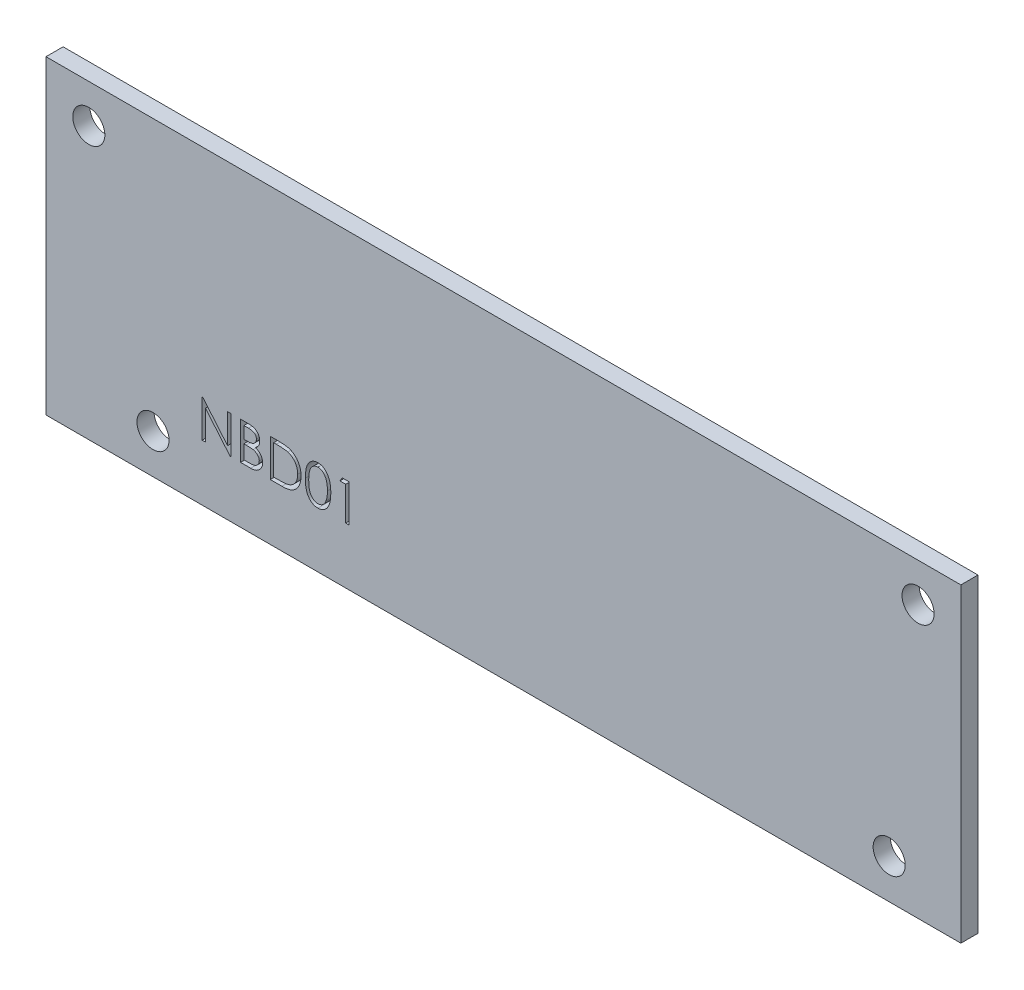
from build123d import *

# Parameters (mm, degrees)
SCHIZZO1_W                   = 85.5
SCHIZZO1_H                   = 29
ESTRUSIONE_ESTRUSIONE1_DEPTH = 1.6
SCHIZZO2_R                   = 1.5
TAGLIO_ESTRUSIONE1_DEPTH     = 1.6


with BuildPart() as part:
    # Schizzo1 → Estrusione-Estrusione1 (new body)
    with BuildSketch(Plane.XY):
        Rectangle(SCHIZZO1_W, SCHIZZO1_H)
    extrude(amount=ESTRUSIONE_ESTRUSIONE1_DEPTH)

    # Schizzo2 → Taglio-Estrusione1 (cut)
    # profile 1 of 9: a face of its own
    with BuildSketch(Plane.XY.offset(1.6)):
        with Locations((-32.75, -10.8)):
            Circle(SCHIZZO2_R)
    # profile 2 of 9: a face of its own
    with BuildSketch(Plane.XY.offset(1.6)):
        with Locations((36.05, -10.8)):
            Circle(SCHIZZO2_R)
    # profile 3 of 9: a face of its own
    with BuildSketch(Plane.XY.offset(1.6)):
        with Locations((38.75, 10.9)):
            Circle(SCHIZZO2_R)
    # profile 4 of 9: a face of its own
    with BuildSketch(Plane.XY.offset(1.6)):
        with Locations((-38.75, 10.9)):
            Circle(SCHIZZO2_R)
    # profile 5 of 9: a face of its own
    with BuildSketch(Plane.XY.offset(1.6)):
        Polygon((-28.159058357, -9.243738305), (-28.159058357, -5.743738305), (-28.093152909, -5.743738305), (-25.780853229, -8.498445837), (-25.780853229, -5.743738305), (-25.466750665, -5.743738305), (-25.466750665, -9.243738305), (-25.538265088, -9.243738305), (-27.844955793, -6.495340869), (-27.844955793, -9.243738305), align=None)
    # profile 6 of 9: a face of its own
    with BuildSketch(Plane.XY.offset(1.6)):
        with BuildLine():
            Line((-24.569314767, -5.743738305), (-23.886422139, -5.743738305))
            add(Edge.make_bspline(
                [(-23.886422139, -5.743738305), (-23.852993661, -5.743914055), (-23.788200951, -5.744254703), (-23.693981509, -5.749537835), (-23.605732698, -5.756741504), (-23.523428926, -5.768171597), (-23.447108224, -5.781963374), (-23.376540586, -5.79866519), (-23.311950414, -5.818691804), (-23.234837678, -5.850538085), (-23.146917017, -5.897861254), (-23.051718624, -5.967789819), (-22.970314385, -6.053322282), (-22.900128067, -6.149804937), (-22.844326948, -6.255940709), (-22.803957651, -6.369199898), (-22.778399775, -6.48812164), (-22.775771341, -6.569764818), (-22.774442973, -6.611025965)],
                knots=[0, 0, 0, 0, 1.001505555, 1.941167018, 2.826882275, 3.653841531, 4.429895133, 5.150066043, 5.825578002, 6.45369114, 7.647487171, 8.808567382, 9.977351308, 11.170798116, 12.373658725, 13.556498008, 14.765093433, 16, 16, 16, 16], degree=3))
            add(Edge.make_bspline(
                [(-22.774442973, -6.611025965), (-22.775536191, -6.649678521), (-22.777684468, -6.725634438), (-22.798227228, -6.836728547), (-22.830387896, -6.942479766), (-22.875093145, -7.042502151), (-22.933195142, -7.134535765), (-23.00205346, -7.219323031), (-23.085130263, -7.293274088), (-23.147373503, -7.33461699), (-23.178990248, -7.355617311)],
                knots=[0, 0, 0, 0, 1.044552857, 2.05264487, 3.044412934, 4.028983338, 5.005914585, 5.980388656, 6.974128949, 8, 8, 8, 8], degree=3))
            add(Edge.make_bspline(
                [(-23.178990248, -7.355617311), (-23.139229821, -7.37088231), (-23.063158273, -7.400088035), (-22.958472261, -7.451723499), (-22.868277416, -7.507885609), (-22.79188027, -7.569217459), (-22.726542615, -7.63532627), (-22.669489673, -7.707181384), (-22.620808299, -7.785720142), (-22.579095376, -7.870123678), (-22.54654662, -7.959530146), (-22.522170715, -8.053100922), (-22.508203266, -8.150500477), (-22.506215625, -8.216785857), (-22.505212203, -8.250248722)],
                knots=[0, 0, 0, 0, 1.27268992, 2.434971085, 3.483601985, 4.442670788, 5.356604649, 6.2567628, 7.179492994, 8.113709626, 9.066344395, 10.018646069, 10.999752585, 12, 12, 12, 12], degree=3))
            add(Edge.make_bspline(
                [(-22.505212203, -8.250248722), (-22.506189049, -8.284415594), (-22.508111021, -8.351639872), (-22.522290993, -8.450395006), (-22.5463001, -8.544769953), (-22.579371246, -8.635375136), (-22.622533561, -8.72203527), (-22.675061525, -8.804848534), (-22.737693089, -8.882982865), (-22.807755958, -8.957306488), (-22.887018103, -9.024134275), (-22.972533858, -9.083649982), (-23.065380178, -9.132596044), (-23.164032172, -9.173712066), (-23.269596488, -9.205119264), (-23.381599096, -9.227091838), (-23.499943398, -9.241896875), (-23.581153149, -9.24311408), (-23.622800344, -9.243738305)],
                knots=[0, 0, 0, 0, 0.978564426, 1.925352924, 2.850884081, 3.763762016, 4.682927383, 5.618979971, 6.567305752, 7.547517671, 8.540179244, 9.531824382, 10.526200242, 11.540722885, 12.589160233, 13.674978461, 14.80764778, 16, 16, 16, 16], degree=3))
            Line((-23.622800344, -9.243738305), (-24.569314767, -9.243738305))
            Line((-24.569314767, -9.243738305), (-24.569314767, -5.743738305))
        make_face()
        with BuildLine():
            Line((-24.255212203, -6.102712664), (-24.255212203, -7.224507536))
            Line((-24.255212203, -7.224507536), (-24.044174543, -7.224507536))
            add(Edge.make_bspline(
                [(-24.044174543, -7.224507536), (-24.013325748, -7.224107613), (-23.953719589, -7.22333488), (-23.867399692, -7.221121363), (-23.787274674, -7.21492332), (-23.713482841, -7.208727057), (-23.646140397, -7.19865247), (-23.585396535, -7.186660347), (-23.530297938, -7.173977442), (-23.466758393, -7.152407955), (-23.394685444, -7.12053028), (-23.31785234, -7.071058444), (-23.250117871, -7.01213409), (-23.192920683, -6.944143129), (-23.146109212, -6.869276943), (-23.113595497, -6.788730062), (-23.091548213, -6.70450993), (-23.089556682, -6.646691678), (-23.088545537, -6.617336061)],
                knots=[0, 0, 0, 0, 1.156816544, 2.235205308, 3.236616184, 4.169592532, 5.011045266, 5.787822928, 6.49130361, 7.128639758, 8.301311294, 9.436451833, 10.541879658, 11.654887649, 12.756523258, 13.837046038, 14.901820046, 16, 16, 16, 16], degree=3))
            add(Edge.make_bspline(
                [(-23.088545537, -6.617336061), (-23.089071717, -6.59791029), (-23.090103877, -6.559804518), (-23.098557179, -6.504255164), (-23.112924754, -6.452011411), (-23.131379047, -6.402357301), (-23.157167736, -6.356845451), (-23.187531199, -6.313902255), (-23.224216889, -6.274990136), (-23.265974202, -6.238620638), (-23.313982825, -6.20637611), (-23.368214117, -6.178135347), (-23.429401794, -6.15539457), (-23.496514649, -6.135478418), (-23.570585736, -6.121490124), (-23.65076029, -6.109836736), (-23.737695009, -6.103903994), (-23.797840111, -6.103118632), (-23.828930152, -6.102712664)],
                knots=[0, 0, 0, 0, 0.91205012, 1.789085906, 2.630437955, 3.453916878, 4.269457761, 5.079663411, 5.91843418, 6.774407191, 7.675494373, 8.627863946, 9.638891023, 10.736472738, 11.911756761, 13.175263542, 14.539845004, 16, 16, 16, 16], degree=3))
            Line((-23.828930152, -6.102712664), (-24.255212203, -6.102712664))
        make_face(mode=Mode.SUBTRACT)
        with BuildLine():
            Line((-24.255212203, -7.583481895), (-24.255212203, -8.884763946))
            Line((-24.255212203, -8.884763946), (-23.807896498, -8.884763946))
            add(Edge.make_bspline(
                [(-23.807896498, -8.884763946), (-23.775877572, -8.884380199), (-23.714165314, -8.883640576), (-23.625064084, -8.881226022), (-23.54248098, -8.875733746), (-23.466792844, -8.867087896), (-23.397182391, -8.857709447), (-23.334484688, -8.845098166), (-23.278191495, -8.830649206), (-23.212917187, -8.808315033), (-23.139413679, -8.773618562), (-23.060202823, -8.721304336), (-22.989776604, -8.658981028), (-22.929971345, -8.586850114), (-22.880958357, -8.508418787), (-22.845302902, -8.425273437), (-22.823312045, -8.33878791), (-22.820649876, -8.279821197), (-22.819314767, -8.250248722)],
                knots=[0, 0, 0, 0, 1.160039823, 2.235823828, 3.228722157, 4.157150951, 4.99529583, 5.772374946, 6.472645482, 7.099169577, 8.269452708, 9.405989375, 10.527446681, 11.663510218, 12.788923519, 13.866172445, 14.929861265, 16, 16, 16, 16], degree=3))
            add(Edge.make_bspline(
                [(-22.819314767, -8.250248722), (-22.819590872, -8.231755381), (-22.820138627, -8.195066999), (-22.828399242, -8.14115118), (-22.840413112, -8.088925307), (-22.855944546, -8.038247566), (-22.878564013, -7.99003419), (-22.904970558, -7.94333163), (-22.935931959, -7.898078151), (-22.984176125, -7.840865898), (-23.05434811, -7.774948885), (-23.154054885, -7.710411382), (-23.267427183, -7.658363575), (-23.349654676, -7.636264099), (-23.392131274, -7.624848081)],
                knots=[0, 0, 0, 0, 0.723448775, 1.435228256, 2.130040452, 2.821711965, 3.505591119, 4.210454504, 4.921174351, 5.648778258, 7.137944449, 8.670945889, 10.280296675, 12, 12, 12, 12], degree=3))
            add(Edge.make_bspline(
                [(-23.392131274, -7.624848081), (-23.40916037, -7.621392997), (-23.446082962, -7.613901662), (-23.506290543, -7.605993959), (-23.575026411, -7.598948899), (-23.652449289, -7.593737741), (-23.73865713, -7.588351197), (-23.833834048, -7.586256376), (-23.937591363, -7.583757116), (-24.009583736, -7.583575982), (-24.04697903, -7.583481895)],
                knots=[0, 0, 0, 0, 0.634451884, 1.375622551, 2.216452059, 3.157844607, 4.20941857, 5.370758133, 6.634282058, 8, 8, 8, 8], degree=3))
            Line((-24.04697903, -7.583481895), (-24.255212203, -7.583481895))
        make_face(mode=Mode.SUBTRACT)
    # profile 7 of 9: a face of its own
    with BuildSketch(Plane.XY.offset(1.6)):
        with BuildLine():
            Line((-21.787263485, -9.243738305), (-21.787263485, -5.743738305))
            Line((-21.787263485, -5.743738305), (-21.080532716, -5.743738305))
            add(Edge.make_bspline(
                [(-21.080532716, -5.743738305), (-21.019063728, -5.744180875), (-20.900305963, -5.745035918), (-20.728693515, -5.750457309), (-20.569909753, -5.760047775), (-20.424476894, -5.774017301), (-20.291995682, -5.791170335), (-20.172837074, -5.812670739), (-20.066384931, -5.838058909), (-20.00091549, -5.85970436), (-19.969955793, -5.869940228)],
                knots=[0, 0, 0, 0, 1.314313732, 2.53924729, 3.670748893, 4.714932338, 5.66265055, 6.526160246, 7.303039223, 8, 8, 8, 8], degree=3))
            add(Edge.make_bspline(
                [(-19.969955793, -5.869940228), (-19.929461054, -5.885370934), (-19.849389862, -5.915882428), (-19.735382739, -5.973438729), (-19.628057376, -6.038651831), (-19.526838231, -6.111607694), (-19.434037405, -6.194372042), (-19.346029508, -6.283429128), (-19.266414784, -6.382017468), (-19.193506488, -6.488092456), (-19.127770829, -6.600404508), (-19.070631671, -6.718739617), (-19.023177678, -6.842496825), (-18.983784451, -6.971331973), (-18.952737993, -7.105528351), (-18.931556062, -7.245242217), (-18.917585072, -7.389921406), (-18.91618102, -7.48809587), (-18.915468614, -7.537908978)],
                knots=[0, 0, 0, 0, 0.984719456, 1.947108742, 2.898477687, 3.838006223, 4.779231079, 5.722358779, 6.681677486, 7.655904652, 8.64651281, 9.637519902, 10.640069247, 11.656948941, 12.698408672, 13.768548281, 14.867775369, 16, 16, 16, 16], degree=3))
            add(Edge.make_bspline(
                [(-18.915468614, -7.537908978), (-18.916097581, -7.581170217), (-18.917337027, -7.666421005), (-18.928466343, -7.792061901), (-18.944642663, -7.913975472), (-18.969686861, -8.031581172), (-19.000089374, -8.14590939), (-19.039053526, -8.255741635), (-19.083689022, -8.362085444), (-19.1357389, -8.46350292), (-19.192880285, -8.559586292), (-19.254202029, -8.65016182), (-19.319638724, -8.733937042), (-19.389814357, -8.811165654), (-19.463822073, -8.881731233), (-19.542146404, -8.946223248), (-19.624989455, -9.003379803), (-19.711980178, -9.055446911), (-19.805656307, -9.100867267), (-19.907792173, -9.139297276), (-20.018823351, -9.171143892), (-20.138477308, -9.197714788), (-20.266960786, -9.21879209), (-20.404399751, -9.232918483), (-20.550583041, -9.242471415), (-20.650962306, -9.243307809), (-20.702628069, -9.243738305)],
                knots=[0, 0, 0, 0, 1.105936401, 2.179363191, 3.223086493, 4.248585256, 5.251745608, 6.245858792, 7.225916811, 8.198733463, 9.158002045, 10.082870192, 10.993790845, 11.873723703, 12.748670949, 13.606408763, 14.465103618, 15.319838547, 16.196477973, 17.123216899, 18.106603292, 19.147568657, 20.255746949, 21.433717677, 22.679120308, 24, 24, 24, 24], degree=3))
            Line((-20.702628069, -9.243738305), (-21.787263485, -9.243738305))
        make_face()
        with BuildLine():
            Line((-21.473160921, -8.884763946), (-21.071418133, -8.884763946))
            add(Edge.make_bspline(
                [(-21.071418133, -8.884763946), (-21.013689762, -8.88451585), (-20.902656964, -8.884038669), (-20.742998966, -8.879851466), (-20.59711957, -8.873009529), (-20.464998061, -8.863434451), (-20.346709036, -8.850765836), (-20.242005286, -8.836640933), (-20.151230028, -8.819043482), (-20.096300591, -8.803092523), (-20.070917332, -8.795721478)],
                knots=[0, 0, 0, 0, 1.375205317, 2.645023457, 3.804390687, 4.853969522, 5.800190428, 6.637939096, 7.370582563, 8, 8, 8, 8], degree=3))
            add(Edge.make_bspline(
                [(-20.070917332, -8.795721478), (-20.03896897, -8.78446992), (-19.975835331, -8.762235547), (-19.884954246, -8.721677885), (-19.800197241, -8.673635816), (-19.720087216, -8.620233542), (-19.645760561, -8.55958754), (-19.576336444, -8.493016551), (-19.511954643, -8.420181776), (-19.453280335, -8.341173614), (-19.400772031, -8.256483819), (-19.355300802, -8.166944985), (-19.31544927, -8.073538175), (-19.284170677, -7.974829016), (-19.259655093, -7.871699958), (-19.242290405, -7.764143744), (-19.231475681, -7.652180462), (-19.230214233, -7.576028338), (-19.229571178, -7.537207856)],
                knots=[0, 0, 0, 0, 0.998632004, 1.973411704, 2.929992603, 3.868527914, 4.809262121, 5.754881198, 6.702106254, 7.672490631, 8.653608572, 9.636854334, 10.631411391, 11.644891563, 12.686317036, 13.754757253, 14.855430412, 16, 16, 16, 16], degree=3))
            add(Edge.make_bspline(
                [(-19.229571178, -7.537207856), (-19.230084465, -7.496274376), (-19.231092823, -7.415860192), (-19.243767133, -7.297869496), (-19.262288689, -7.184388846), (-19.289072375, -7.07541065), (-19.323203253, -6.970722298), (-19.365797895, -6.870902788), (-19.414464515, -6.774897919), (-19.472367851, -6.684923553), (-19.535783445, -6.599830444), (-19.606161324, -6.521875529), (-19.682383363, -6.450881228), (-19.763618212, -6.385741916), (-19.852155311, -6.32907824), (-19.945909002, -6.278391559), (-20.046254673, -6.235375667), (-20.116067369, -6.212496805), (-20.151546338, -6.200869715)],
                knots=[0, 0, 0, 0, 1.122418816, 2.205001699, 3.251619955, 4.274784885, 5.280384055, 6.268708349, 7.249350384, 8.229342522, 9.199999885, 10.157847722, 11.105861043, 12.055065948, 13.010012805, 13.98527497, 14.976112212, 16, 16, 16, 16], degree=3))
            add(Edge.make_bspline(
                [(-20.151546338, -6.200869715), (-20.180897484, -6.192753287), (-20.243306075, -6.175495535), (-20.345145539, -6.156670162), (-20.459760688, -6.140065663), (-20.587660389, -6.126007624), (-20.728698848, -6.115920303), (-20.882984536, -6.108348988), (-21.050584141, -6.103242355), (-21.166766675, -6.102893648), (-21.227067171, -6.102712664)],
                knots=[0, 0, 0, 0, 0.674548936, 1.434276114, 2.292660221, 3.240891867, 4.284742987, 5.42552168, 6.663806718, 8, 8, 8, 8], degree=3))
            Line((-21.227067171, -6.102712664), (-21.473160921, -6.102712664))
            Line((-21.473160921, -6.102712664), (-21.473160921, -8.884763946))
        make_face(mode=Mode.SUBTRACT)
    # profile 8 of 9: a face of its own
    with BuildSketch(Plane.XY.offset(1.6)):
        with BuildLine():
            add(Edge.make_bspline(
                [(-18.51162246, -7.495140549), (-18.511294442, -7.439043161), (-18.510657262, -7.330073177), (-18.503568841, -7.171288535), (-18.491793498, -7.022328246), (-18.475656126, -6.883185179), (-18.456018145, -6.753823415), (-18.429802659, -6.634588658), (-18.399989856, -6.524929051), (-18.36543741, -6.424487003), (-18.326449621, -6.3319093), (-18.284015361, -6.245484098), (-18.236450566, -6.165342166), (-18.186473653, -6.090204376), (-18.132061582, -6.021300681), (-18.074762791, -5.957658018), (-18.012340915, -5.900747268), (-17.946917907, -5.848900966), (-17.877901442, -5.803451494), (-17.807258776, -5.763418755), (-17.73450367, -5.729218888), (-17.659437487, -5.702328452), (-17.582734929, -5.680117605), (-17.504127863, -5.664928658), (-17.423486499, -5.655371749), (-17.369055064, -5.654458081), (-17.341450184, -5.653994715)],
                knots=[0, 0, 0, 0, 1.646270934, 3.197905019, 4.663502075, 6.030701355, 7.308322542, 8.50163776, 9.611534131, 10.641858119, 11.616356847, 12.558055219, 13.465016945, 14.349605745, 15.204443733, 16.039544428, 16.859896111, 17.680448484, 18.487036065, 19.28249412, 20.06191084, 20.843045899, 21.620316918, 22.403196591, 23.190181807, 24, 24, 24, 24], degree=3))
            add(Edge.make_bspline(
                [(-17.341450184, -5.653994715), (-17.313614706, -5.65448253), (-17.258258697, -5.655452641), (-17.176418322, -5.664776584), (-17.09646864, -5.680247707), (-17.018750501, -5.702168682), (-16.942625515, -5.729364358), (-16.868689107, -5.763451475), (-16.796482025, -5.803130343), (-16.727151738, -5.84975422), (-16.659937122, -5.901736496), (-16.59648916, -5.960499165), (-16.536802074, -6.025448884), (-16.480126768, -6.095890748), (-16.428071171, -6.173175833), (-16.378497739, -6.255959943), (-16.334125703, -6.345690808), (-16.291391028, -6.440871275), (-16.254504041, -6.544134934), (-16.221237796, -6.654899695), (-16.194358827, -6.774473882), (-16.171969555, -6.902230127), (-16.154624659, -7.03863761), (-16.141992017, -7.183403926), (-16.135318932, -7.336624316), (-16.134062231, -7.441382165), (-16.133417332, -7.495140549)],
                knots=[0, 0, 0, 0, 0.810914788, 1.612654377, 2.396697861, 3.181598691, 3.963628158, 4.749916497, 5.551656086, 6.361998678, 7.18212741, 8.025565596, 8.878627764, 9.750805457, 10.657531673, 11.591944965, 12.560506719, 13.57287815, 14.630710178, 15.753379473, 16.941251878, 18.199788006, 19.531962791, 20.947069417, 22.433333509, 24, 24, 24, 24], degree=3))
            add(Edge.make_bspline(
                [(-16.133417332, -7.495140549), (-16.134068916, -7.548664457), (-16.135338502, -7.652953608), (-16.141917209, -7.805484584), (-16.15487584, -7.949482627), (-16.171085828, -8.085293089), (-16.193536791, -8.212350708), (-16.221141958, -8.331095157), (-16.25179228, -8.442039228), (-16.289627074, -8.54427404), (-16.331037785, -8.639225763), (-16.376092981, -8.727892911), (-16.424362807, -8.811059204), (-16.476951552, -8.888058951), (-16.533004965, -8.959437608), (-16.593722754, -9.023935231), (-16.657393339, -9.083105903), (-16.724805755, -9.13575753), (-16.795217306, -9.181842335), (-16.867176383, -9.223056185), (-16.941959766, -9.25628888), (-17.017872719, -9.284823921), (-17.096001085, -9.306624373), (-17.176247476, -9.321698228), (-17.258203712, -9.332270077), (-17.313605277, -9.333076557), (-17.341450184, -9.333481895)],
                knots=[0, 0, 0, 0, 1.561518951, 3.042555995, 4.452378317, 5.7783523, 7.031515105, 8.214008947, 9.334062868, 10.386615937, 11.391082383, 12.354592575, 13.286541444, 14.194233754, 15.072674879, 15.931287219, 16.775624067, 17.606195743, 18.42308326, 19.229000347, 20.022332153, 20.807536673, 21.593273796, 22.3848459, 23.188221202, 24, 24, 24, 24], degree=3))
            add(Edge.make_bspline(
                [(-17.341450184, -9.333481895), (-17.369054298, -9.333015539), (-17.423484223, -9.332095977), (-17.504136648, -9.322582246), (-17.582419092, -9.307286743), (-17.658717846, -9.285870139), (-17.733424361, -9.259655302), (-17.805520648, -9.225501619), (-17.875808331, -9.18616755), (-17.944099887, -9.141372128), (-18.009112048, -9.090050445), (-18.071210654, -9.033286156), (-18.128835673, -8.969662745), (-18.182469768, -8.900184822), (-18.233443857, -8.82549158), (-18.28033323, -8.744563207), (-18.323704084, -8.657720596), (-18.363347575, -8.564402685), (-18.398496238, -8.463247758), (-18.429543946, -8.353098579), (-18.454058104, -8.232982943), (-18.475041059, -8.103865576), (-18.491965442, -7.965191645), (-18.503519767, -7.816885867), (-18.510661082, -7.659040658), (-18.511296153, -7.550770884), (-18.51162246, -7.495140549)],
                knots=[0, 0, 0, 0, 0.810891512, 1.598919785, 2.382837074, 3.152667961, 3.926044502, 4.706494248, 5.493654104, 6.291793342, 7.103789334, 7.925228297, 8.761435821, 9.622817696, 10.50288917, 11.416980706, 12.369136599, 13.353924996, 14.394355917, 15.514179734, 16.714354668, 17.994756427, 19.357759367, 20.818452758, 22.365282078, 24, 24, 24, 24], degree=3))
        make_face()
        with BuildLine():
            add(Edge.make_bspline(
                [(-18.197519896, -7.493738305), (-18.197400449, -7.540487004), (-18.197168625, -7.631217049), (-18.191112425, -7.76306031), (-18.182862193, -7.886030638), (-18.172220896, -8.000284175), (-18.156417947, -8.105434187), (-18.138711159, -8.20220387), (-18.11716307, -8.290081108), (-18.091668052, -8.369668918), (-18.062628955, -8.442317987), (-18.030923091, -8.509919202), (-17.996862368, -8.573271138), (-17.958743218, -8.631804747), (-17.917228154, -8.685710911), (-17.873254895, -8.735943743), (-17.825182311, -8.780740724), (-17.758678569, -8.834467579), (-17.670882094, -8.889986713), (-17.560261639, -8.938332803), (-17.446593188, -8.968715259), (-17.369441938, -8.972579015), (-17.330933357, -8.974507536)],
                knots=[0, 0, 0, 0, 1.459021318, 2.831673884, 4.118529203, 5.306027144, 6.411944654, 7.436330062, 8.375795394, 9.233974572, 10.042671642, 10.816086306, 11.563610507, 12.285937304, 12.993564865, 13.685989202, 14.367179055, 15.041617293, 16.353048772, 17.594441528, 18.799311195, 20, 20, 20, 20], degree=3))
            add(Edge.make_bspline(
                [(-17.330933357, -8.974507536), (-17.292175686, -8.972909755), (-17.214740362, -8.969717492), (-17.101606567, -8.938918755), (-16.991776297, -8.892449215), (-16.905704357, -8.83750171), (-16.840221813, -8.78517338), (-16.793304823, -8.740558732), (-16.750242775, -8.690602865), (-16.7094007, -8.636703569), (-16.671941624, -8.577831085), (-16.637878487, -8.514268509), (-16.606795139, -8.445839332), (-16.589086093, -8.398069592), (-16.580031915, -8.373646158)],
                knots=[0, 0, 0, 0, 1.353760809, 2.704726607, 4.075137775, 5.516104923, 6.260822281, 7.007110065, 7.778089737, 8.566572457, 9.372053459, 10.217411131, 11.088608312, 12, 12, 12, 12], degree=3))
            add(Edge.make_bspline(
                [(-16.580031915, -8.373646158), (-16.569480147, -8.342416418), (-16.548055533, -8.279006654), (-16.520443759, -8.180643002), (-16.49869836, -8.077440238), (-16.479134994, -7.970015121), (-16.465781938, -7.85757542), (-16.455034125, -7.740469036), (-16.448703438, -7.618607674), (-16.447918687, -7.535812683), (-16.447519896, -7.493738305)],
                knots=[0, 0, 0, 0, 0.884706709, 1.796334032, 2.740027952, 3.714592787, 4.726048262, 5.777819803, 6.87074269, 8, 8, 8, 8], degree=3))
            add(Edge.make_bspline(
                [(-16.447519896, -7.493738305), (-16.448070085, -7.451670732), (-16.449146373, -7.369377568), (-16.45326036, -7.248859387), (-16.463883935, -7.134391626), (-16.475683054, -7.025481153), (-16.493080275, -6.922730851), (-16.511838082, -6.825280545), (-16.537039294, -6.734337521), (-16.563959069, -6.648477939), (-16.594769465, -6.568677284), (-16.628685199, -6.494563498), (-16.664906958, -6.425778773), (-16.704249198, -6.362511832), (-16.746244881, -6.304479289), (-16.79200243, -6.252844694), (-16.839706803, -6.206007726), (-16.906523989, -6.152545157), (-16.993998279, -6.098033462), (-17.102843926, -6.047867702), (-17.21611457, -6.019059409), (-17.292688024, -6.014997722), (-17.330933357, -6.012969074)],
                knots=[0, 0, 0, 0, 1.31362396, 2.569729283, 3.763502607, 4.902122613, 5.988968491, 7.01645872, 7.998833611, 8.933434873, 9.825090667, 10.667526885, 11.477055099, 12.250526234, 12.991942729, 13.710640831, 14.402115721, 15.076753259, 16.378508321, 17.609869233, 18.806226677, 20, 20, 20, 20], degree=3))
            add(Edge.make_bspline(
                [(-17.330933357, -6.012969074), (-17.369643949, -6.015000521), (-17.447135655, -6.019067115), (-17.56158361, -6.047760369), (-17.671287961, -6.097773334), (-17.758530936, -6.152725707), (-17.825394722, -6.205064018), (-17.872477416, -6.250450472), (-17.916623588, -6.300096727), (-17.957291288, -6.354498642), (-17.995380571, -6.412964009), (-18.030361584, -6.475952774), (-18.061878914, -6.543784138), (-18.09096345, -6.616400573), (-18.116536238, -6.695981518), (-18.137630201, -6.783750511), (-18.157117254, -6.880212403), (-18.170912523, -6.985931911), (-18.183176279, -7.100214065), (-18.191057627, -7.223491383), (-18.197188884, -7.355555763), (-18.197407349, -7.446754922), (-18.197519896, -7.493738305)],
                knots=[0, 0, 0, 0, 1.207732386, 2.417664972, 3.655092373, 4.956220595, 5.625982001, 6.301752483, 6.994047911, 7.697131622, 8.419323945, 9.170223765, 9.943494443, 10.752040957, 11.610060368, 12.549350801, 13.567764191, 14.679664412, 15.874934091, 17.154273443, 18.533957287, 20, 20, 20, 20], degree=3))
        make_face(mode=Mode.SUBTRACT)
    # profile 9 of 9: a face of its own
    with BuildSketch(Plane.XY.offset(1.6)):
        Polygon((-15.075424543, -5.743738305), (-14.428289126, -5.743738305), (-14.428289126, -9.243738305), (-14.742391691, -9.243738305), (-14.742391691, -6.102712664), (-15.280853229, -6.102712664), align=None)
    extrude(amount=-TAGLIO_ESTRUSIONE1_DEPTH, mode=Mode.SUBTRACT)


with BuildPart() as taglio_estrusione1_piece_1:
    # of the separate pieces the step leaves, piece 1, a body of its own (taglio_estrusione1_pieces)
    add(part.part.solids().sort_by_distance((42.75, -14.5, 0))[0])


with BuildPart() as taglio_estrusione1_piece_2:
    # of the separate pieces the step leaves, piece 2, a body of its own (taglio_estrusione1_pieces)
    add(part.part.solids().sort_by_distance((-21.473160921, -8.884763946, 0))[0])


with BuildPart() as taglio_estrusione1_piece_3:
    # of the separate pieces the step leaves, piece 3, a body of its own (taglio_estrusione1_pieces)
    add(part.part.solids().sort_by_distance((-18.197519896, -7.493738305, 0))[0])


with BuildPart() as taglio_estrusione1_piece_4:
    # of the separate pieces the step leaves, piece 4, a body of its own (taglio_estrusione1_pieces)
    add(part.part.solids().sort_by_distance((-24.255212203, -7.583481895, 0))[0])


with BuildPart() as taglio_estrusione1_piece_5:
    # of the separate pieces the step leaves, piece 5, a body of its own (taglio_estrusione1_pieces)
    add(part.part.solids().sort_by_distance((-24.255212203, -6.102712664, 0))[0])


solid = Compound([taglio_estrusione1_piece_1.part, taglio_estrusione1_piece_2.part, taglio_estrusione1_piece_3.part, taglio_estrusione1_piece_4.part, taglio_estrusione1_piece_5.part])
